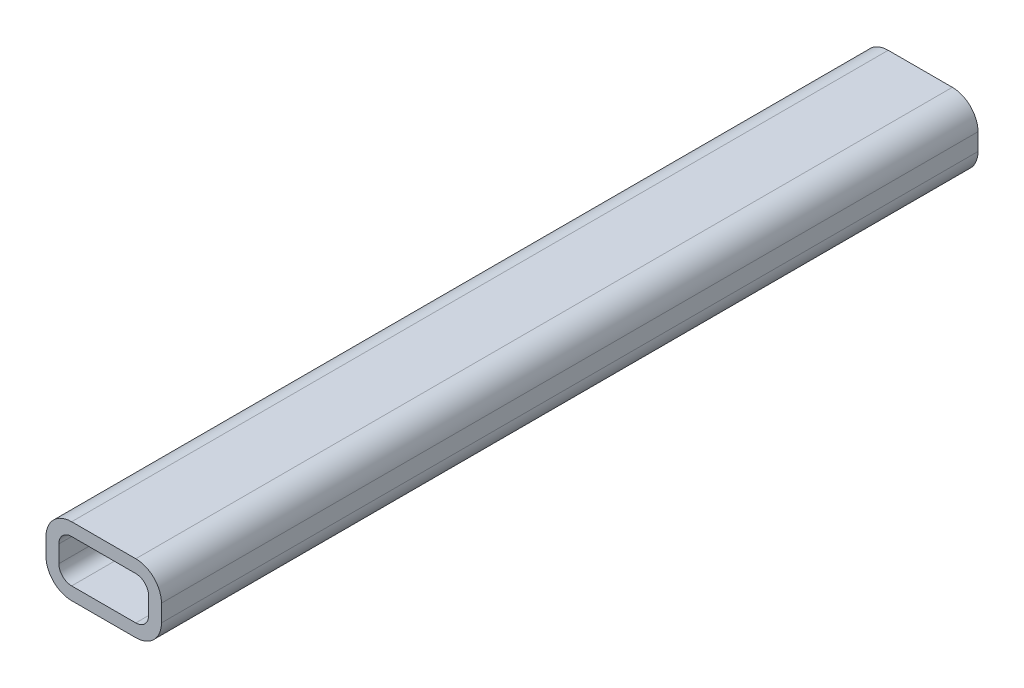
from build123d import *

# Parameters (mm, degrees)
BOSS_EXTRUDE1_DEPTH = 191


with BuildPart() as part:
    # Sketch1 → Boss-Extrude1 (new body)
    with BuildSketch(Plane.XY):
        with BuildLine():
            Line((0, 3), (-15, 3))
            ThreePointArc((-15, 3), (-19.242640687, 1.242640687), (-21, -3))
            Line((-21, -3), (-21, -7))
            ThreePointArc((-21, -7), (-19.242640687, -11.242640687), (-15, -13))
            Line((-15, -13), (0, -13))
            ThreePointArc((0, -13), (4.242640687, -11.242640687), (6, -7))
            Line((6, -7), (6, -3))
            ThreePointArc((6, -3), (4.242640687, 1.242640687), (0, 3))
        make_face()
        with BuildLine():
            Line((0, 0), (-15, 0))
            ThreePointArc((-15, 0), (-17.121320344, -0.878679656), (-18, -3))
            Line((-18, -3), (-18, -7))
            ThreePointArc((-18, -7), (-17.121320344, -9.121320344), (-15, -10))
            Line((-15, -10), (0, -10))
            ThreePointArc((0, -10), (2.121320344, -9.121320344), (3, -7))
            Line((3, -7), (3, -3))
            ThreePointArc((3, -3), (2.121320344, -0.878679656), (0, 0))
        make_face(mode=Mode.SUBTRACT)
    extrude(amount=BOSS_EXTRUDE1_DEPTH)


solid = part.part
